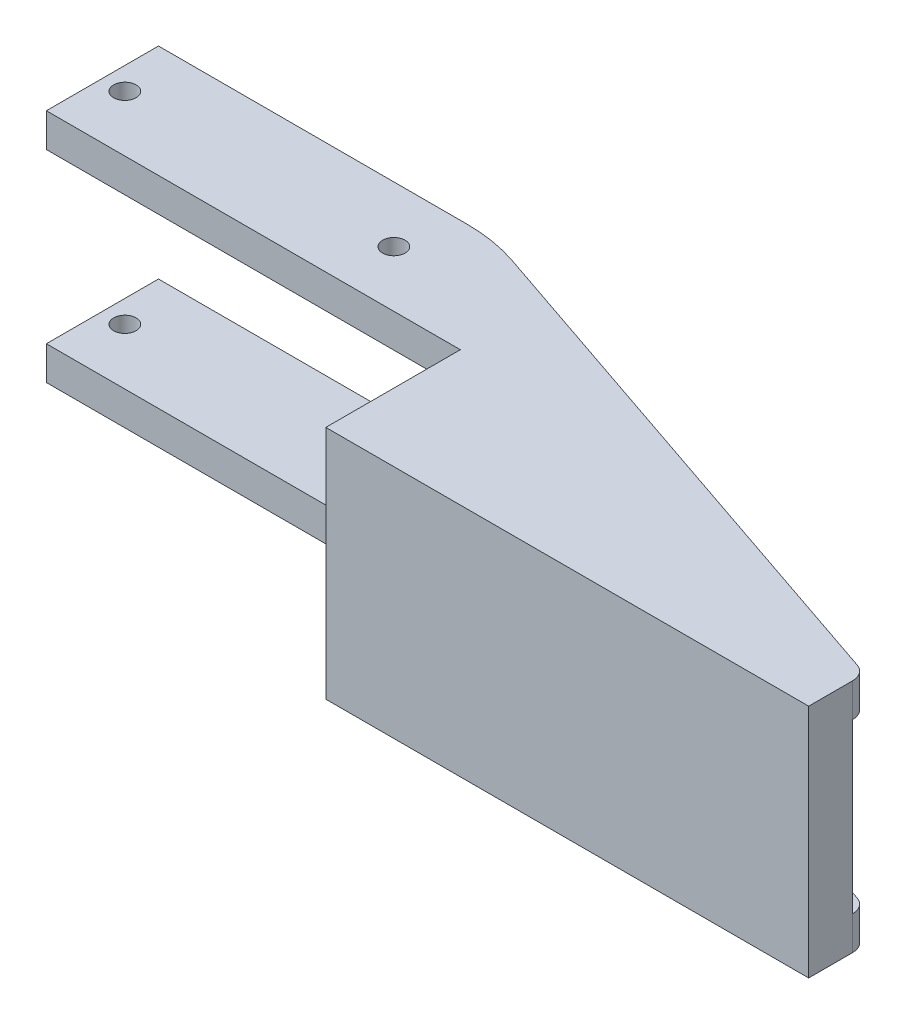
from build123d import *

# Parameters (mm, degrees)
BOSS_EXTRUDE1_DEPTH                      = 3
BOSS_EXTRUDE2_START                      = 15
BOSS_EXTRUDE2_DEPTH                      = 3
SKETCH3_W                                = 1
SKETCH3_H                                = 21
F_2_0MM_CLEARANCE_DOWEL_HOLE1_AT_2_COUNT = 2
F_2_0MM_CLEARANCE_DOWEL_HOLE1_AT_2_PITCH = 24
SKETCH5_W                                = 43.073811931
SKETCH5_H                                = 3.925670489
BOSS_EXTRUDE3_DEPTH                      = 15


with BuildPart() as part:
    # Sketch1 → Boss-Extrude1 (new body)
    with BuildSketch(Plane(origin=(0, 0, 0), x_dir=(1, 0, 0), z_dir=(0, 1, 0))):
        with BuildLine():
            Line((-4.577926811, 9.356292891), (42.056666031, -6.499468675))
            ThreePointArc((42.056666031, -6.499468675), (42.793295664, -7.04620955), (43.073811931, -7.919627792))
            Line((43.073811931, -7.919627792), (43.073811931, -11.845298281))
            Line((43.073811931, -11.845298281), (0, -11.845298281))
            Line((0, -11.845298281), (0, 0.154701719))
            Line((0, 0.154701719), (-36.926188069, 0.154701719))
            Line((-36.926188069, 0.154701719), (-36.926188069, 10.154701719))
            Line((-36.926188069, 10.154701719), (-9.406467809, 10.154701719))
            ThreePointArc((-9.406467809, 10.154701719), (-6.959415254, 9.953753506), (-4.577926811, 9.356292891))
        make_face()
    extrude(amount=-BOSS_EXTRUDE1_DEPTH)


with BuildPart() as body_2:
    # Sketch1<2> → Boss-Extrude2 (new body)
    with BuildSketch(Plane(origin=(0, 0, 0), x_dir=(1, 0, 0), z_dir=(0, 1, 0)).offset(BOSS_EXTRUDE2_START)):
        with BuildLine():
            Line((-4.577926811, 9.356292891), (42.056666031, -6.499468675))
            ThreePointArc((42.056666031, -6.499468675), (42.793295664, -7.04620955), (43.073811931, -7.919627792))
            Line((43.073811931, -7.919627792), (43.073811931, -11.845298281))
            Line((43.073811931, -11.845298281), (0, -11.845298281))
            Line((0, -11.845298281), (0, 0.154701719))
            Line((0, 0.154701719), (-36.926188069, 0.154701719))
            Line((-36.926188069, 0.154701719), (-36.926188069, 10.154701719))
            Line((-36.926188069, 10.154701719), (-9.406467809, 10.154701719))
            ThreePointArc((-9.406467809, 10.154701719), (-6.959415254, 9.953753506), (-4.577926811, 9.356292891))
        make_face()
    extrude(amount=BOSS_EXTRUDE2_DEPTH)


with BuildPart() as f_2_0mm_clearance_dowel_hole1_tool:
    # Sketch3 → Ø2.0mm Clearance Dowel Hole1 (revolve)
    with BuildSketch(Plane(origin=(-34.926188069, -3, -5.154701719), x_dir=(0, 0, -1), z_dir=(1, 0, 0))):
        with Locations((0.5, 10.5)):
            Rectangle(SKETCH3_W, SKETCH3_H)
    f_2_0mm_clearance_dowel_hole1 = revolve(axis=Axis((-34.926188069, -9.35, -5.154701719), (0, 1, 0)))


with BuildPart() as part_1:
    add(part.part)

    # Ø2.0mm Clearance Dowel Hole1: cut by f_2_0mm_clearance_dowel_hole1_tool
    add(f_2_0mm_clearance_dowel_hole1_tool.part, mode=Mode.SUBTRACT)


with BuildPart() as body_2_1:
    add(body_2.part)

    # Ø2.0mm Clearance Dowel Hole1: cut by f_2_0mm_clearance_dowel_hole1_tool
    add(f_2_0mm_clearance_dowel_hole1_tool.part, mode=Mode.SUBTRACT)


with BuildPart() as f_2_0mm_clearance_dowel_hole1_at_2_tool:
    # Ø2.0mm Clearance Dowel Hole1 at 2: Ø2.0mm Clearance Dowel Hole1 ×2
    with Locations(*[(i * F_2_0MM_CLEARANCE_DOWEL_HOLE1_AT_2_PITCH, 0, 0) for i in range(1, F_2_0MM_CLEARANCE_DOWEL_HOLE1_AT_2_COUNT)]):
        add(f_2_0mm_clearance_dowel_hole1)


with BuildPart() as part_2:
    add(part_1.part)

    # Ø2.0mm Clearance Dowel Hole1 at 2: cut by f_2_0mm_clearance_dowel_hole1_at_2_tool
    add(f_2_0mm_clearance_dowel_hole1_at_2_tool.part, mode=Mode.SUBTRACT)



with BuildPart() as body_2_2:
    add(body_2_1.part)

    # Ø2.0mm Clearance Dowel Hole1 at 2: cut by f_2_0mm_clearance_dowel_hole1_at_2_tool
    add(f_2_0mm_clearance_dowel_hole1_at_2_tool.part, mode=Mode.SUBTRACT)


with BuildPart() as part_3:
    add(part_2.part)

    add(body_2_2.part)  # Boss-Extrude3 merges body 2
    # Sketch5 → Boss-Extrude3 (add)
    with BuildSketch(Plane(origin=(0, 0, 0), x_dir=(1, 0, 0), z_dir=(0, 1, 0))):
        with Locations((21.536905966, -9.882463037)):
            Rectangle(SKETCH5_W, SKETCH5_H)
    extrude(amount=BOSS_EXTRUDE3_DEPTH)


solid = part_3.part
